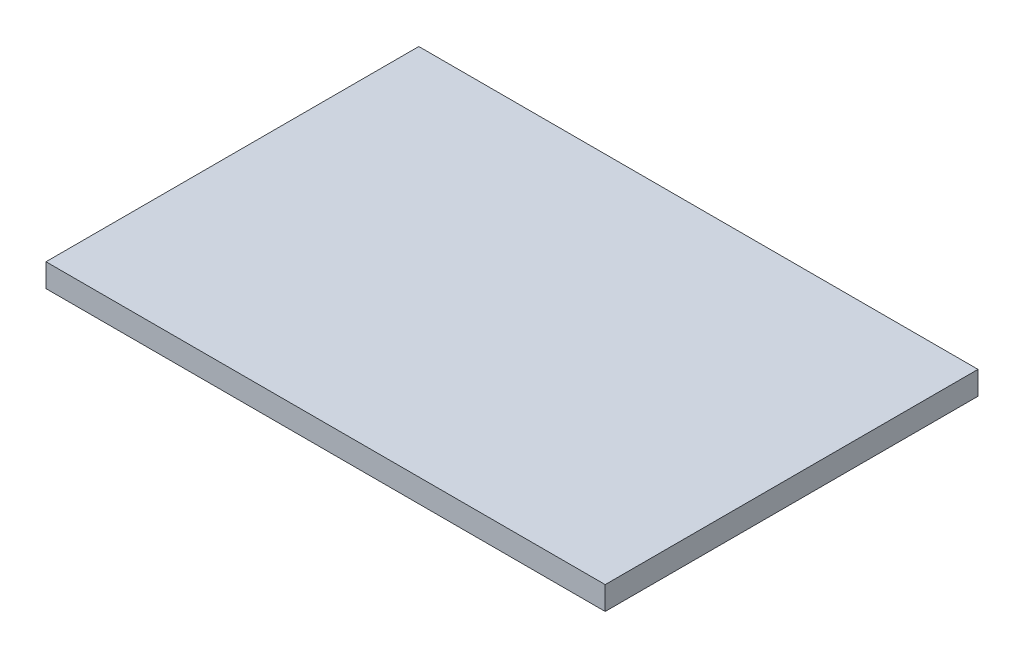
from build123d import *

# Parameters (mm, degrees)
SKETCH1_W           = 457.2
SKETCH1_H           = 304.8
BOSS_EXTRUDE1_DEPTH = 19.05


with BuildPart() as part:
    # Sketch1 → Boss-Extrude1 (new body)
    with BuildSketch(Plane(origin=(0, 0, 0), x_dir=(1, 0, 0), z_dir=(0, 1, 0))):
        Rectangle(SKETCH1_W, SKETCH1_H)
    extrude(amount=BOSS_EXTRUDE1_DEPTH)


solid = part.part
